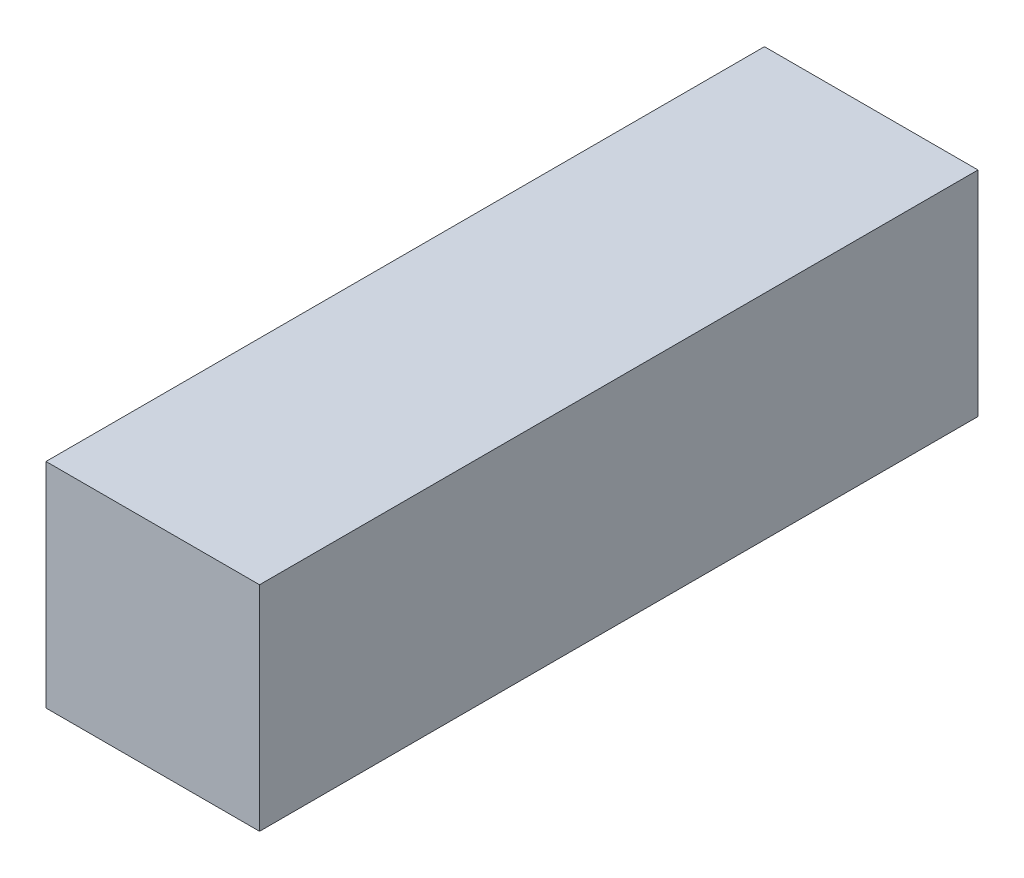
from build123d import *

# Parameters (mm, degrees)
SKETCH1_W           = 19.05
SKETCH1_H           = 64.091275756
BOSS_EXTRUDE1_DEPTH = 19.05


with BuildPart() as part:
    # Sketch1 → Boss-Extrude1 (new body)
    with BuildSketch(Plane(origin=(0, 0, 0), x_dir=(1, 0, 0), z_dir=(0, 1, 0))):
        with Locations((0, -32.045637878)):
            Rectangle(SKETCH1_W, SKETCH1_H)
    extrude(amount=BOSS_EXTRUDE1_DEPTH)


solid = part.part
